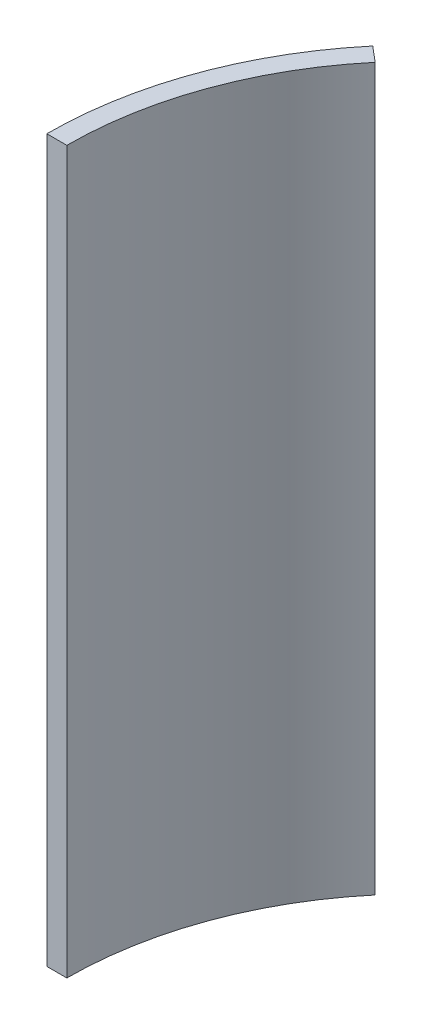
from build123d import *

# Parameters (mm, degrees)
SKETCH1_R           = 2.6
BOSS_EXTRUDE1_DEPTH = 20
BOSS_EXTRUDE2_DEPTH = 180
CUT_EXTRUDE1_DEPTH  = 192.378764777


with BuildPart() as part:
    # Sketch1 → Boss-Extrude1 (new body)
    with BuildSketch(Plane(origin=(0, 0, 0), x_dir=(1, 0, 0), z_dir=(0, 1, 0))):
        with BuildLine():
            Line((10, 0), (-10, 0))
            ThreePointArc((-10, 0), (-4.705844869, 30.024645745), (10.538067282, 56.427876097))
            Line((10.538067282, 56.427876097), (25.858956145, 43.572123903))
            ThreePointArc((25.858956145, 43.572123903), (14.088007547, 23.184242879), (10, 0))
        make_face()
        with Locations(Location((0.645465629, 10, 0), (0, 0, 270))):
            Circle(SKETCH1_R, mode=Mode.SUBTRACT)
        with Locations(Location((4.691081339, 26.604444312, 0), (0, 0, 270))):
            Circle(SKETCH1_R, mode=Mode.SUBTRACT)
        with Locations(Location((12.265090975, 41.92465826, 0), (0, 0, 270))):
            Circle(SKETCH1_R, mode=Mode.SUBTRACT)
    extrude(amount=BOSS_EXTRUDE1_DEPTH)

    # Sketch3 → Cut-Extrude1 (cut, through all)
    with BuildSketch(Plane(origin=(0, 20, 0), x_dir=(1, 0, 0), z_dir=(0, 1, 0))):
        with BuildLine():
            Line((25.858956145, 43.572123903), (10.538067282, 56.427876097))
            ThreePointArc((10.538067282, 56.427876097), (-4.705844869, 30.024645745), (-10, 0))
            Line((-10, 0), (10, 0))
            ThreePointArc((10, 0), (14.088007547, 23.184242879), (25.858956145, 43.572123903))
        make_face()
    extrude(amount=-CUT_EXTRUDE1_DEPTH, mode=Mode.SUBTRACT)


with BuildPart() as body_2:
    # Sketch2 → Boss-Extrude2 (new body)
    with BuildSketch(Plane(origin=(0, 20, 0), x_dir=(1, 0, 0), z_dir=(0, 1, 0))):
        with BuildLine():
            Line((6.707845067, 59.641814145), (10.538067282, 56.427876097))
            ThreePointArc((10.538067282, 56.427876097), (-4.705844869, 30.024645745), (-10, 0))
            Line((-10, 0), (-15, 0))
            ThreePointArc((-15, 0), (-9.404307973, 31.734746462), (6.707845067, 59.641814145))
        make_face()
    extrude(amount=BOSS_EXTRUDE2_DEPTH)


solid = body_2.part
